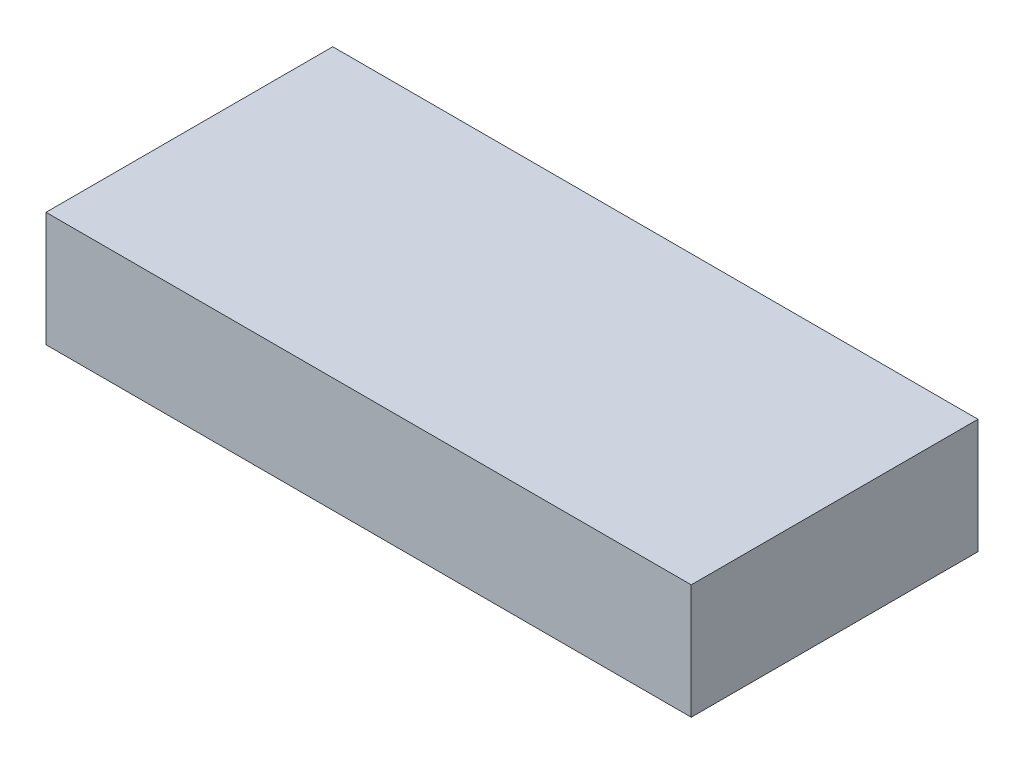
from build123d import *

# Parameters (mm, degrees)
SKETCH_1_W      = 45
SKETCH_1_H      = 8
EXTRUDE_1_DEPTH = 20


with BuildPart() as part:
    # 草图1 → 凸台-拉伸1 (new body)
    with BuildSketch(Plane.XY):
        Rectangle(SKETCH_1_W, SKETCH_1_H)
    extrude(amount=EXTRUDE_1_DEPTH)


solid = part.part
